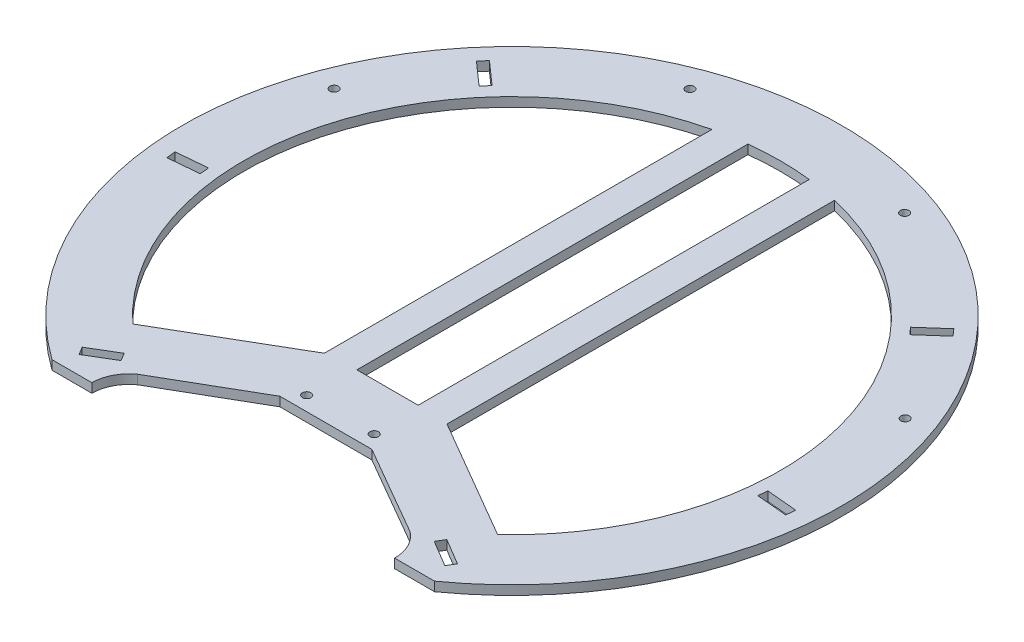
from build123d import *

# Parameters (mm, degrees)
SKETCH5_R           = 1.4
BOSS_EXTRUDE1_DEPTH = 3


with BuildPart() as part:
    # Sketch5 → Boss-Extrude1 (new body)
    with BuildSketch(Plane(origin=(0, 0, 0), x_dir=(1, 0, 0), z_dir=(0, 1, 0))):
        with BuildLine():
            Line((-49.57228919, -87.412577044), (-62.57228919, -87.412577044))
            ThreePointArc((-62.57228919, -87.412577044), (0.15026567, 107.499894978), (62.32767078, -87.5871649))
            Line((62.32767078, -87.5871649), (49.32767078, -87.5871649))
            ThreePointArc((49.32767078, -87.5871649), (48.011633262, -81.999797234), (44.340215544, -77.5871649))
            Line((44.340215544, -77.5871649), (14.895351815, -60.5871649))
            Line((14.895351815, -60.5871649), (-15.104648185, -60.5871649))
            Line((-15.104648185, -60.5871649), (-44.549511914, -77.5871649))
            ThreePointArc((-44.549511914, -77.5871649), (-48.243794441, -81.895172415), (-49.57228919, -87.412577044))
        make_face()
        with Locations(Location((-93.103383397, 35.1, 0), (0, 0, 270))):
            Circle(SKETCH5_R, mode=Mode.SUBTRACT)
        with Locations(Location((35, 93.034187265, 0), (0, 0, 90))):
            Circle(SKETCH5_R, mode=Mode.SUBTRACT)
        with Locations(Location((-35, 93.034187265, 0), (0, 0, 270))):
            Circle(SKETCH5_R, mode=Mode.SUBTRACT)
        with Locations(Location((93.103383397, 35.1, 0), (0, 0, 90))):
            Circle(SKETCH5_R, mode=Mode.SUBTRACT)
        with Locations(Location((-11, -55.928525816, 0), (0, 0, 270))):
            Circle(SKETCH5_R, mode=Mode.SUBTRACT)
        with Locations(Location((11, -55.928525816, 0), (0, 0, 90))):
            Circle(SKETCH5_R, mode=Mode.SUBTRACT)
        with BuildLine():
            Line((-59.488560992, -64.166666667), (-20, -41.195529316))
            Line((-20, -41.195529316), (-20, 85.183625187))
            ThreePointArc((-20, 85.183625187), (-84.593056756, 22.366598952), (-59.488560992, -64.166666667))
        make_face(mode=Mode.SUBTRACT)
        with BuildLine():
            Line((-10, -40.5871649), (10, -40.5871649))
            Line((10, -40.5871649), (10, 86.926693254))
            ThreePointArc((10, 86.926693254), (0, 87.5), (-10, 86.926693254))
            Line((-10, 86.926693254), (-10, -40.5871649))
        make_face(mode=Mode.SUBTRACT)
        with BuildLine():
            Line((20, -41.195529316), (59.488560992, -64.166666667))
            ThreePointArc((59.488560992, -64.166666667), (84.593056756, 22.366598952), (20, 85.183625187))
            Line((20, 85.183625187), (20, -41.195529316))
        make_face(mode=Mode.SUBTRACT)
        Polygon((-100.9, -11.654989132), (-101.17241918, -8.667383437), (-91.17241918, -7.755552333), (-90.9, -10.743158028), align=None, mode=Mode.SUBTRACT)
        Polygon((-77.70280139, 66.108380167), (-75.71415707, 68.354553306), (-68.226913275, 61.725738906), (-70.215557595, 59.479565767), align=None, mode=Mode.SUBTRACT)
        Polygon((77.70280139, 66.108380167), (75.71415707, 68.354553306), (68.226913275, 61.725738906), (70.215557595, 59.479565767), align=None, mode=Mode.SUBTRACT)
        Polygon((100.9, -11.654989132), (90.9, -10.743158028), (91.17241918, -7.755552333), (101.17241918, -8.667383437), align=None, mode=Mode.SUBTRACT)
        Polygon((-61.179766354, -78.961014389), (-52.592640519, -73.836439294), (-51.055267991, -76.412577044), (-59.642393825, -81.537152139), align=None, mode=Mode.SUBTRACT)
        Polygon((52.592640519, -73.836439294), (51.055267991, -76.412577044), (59.642393825, -81.537152139), (61.179766354, -78.961014389), align=None, mode=Mode.SUBTRACT)
    extrude(amount=BOSS_EXTRUDE1_DEPTH)


solid = part.part
